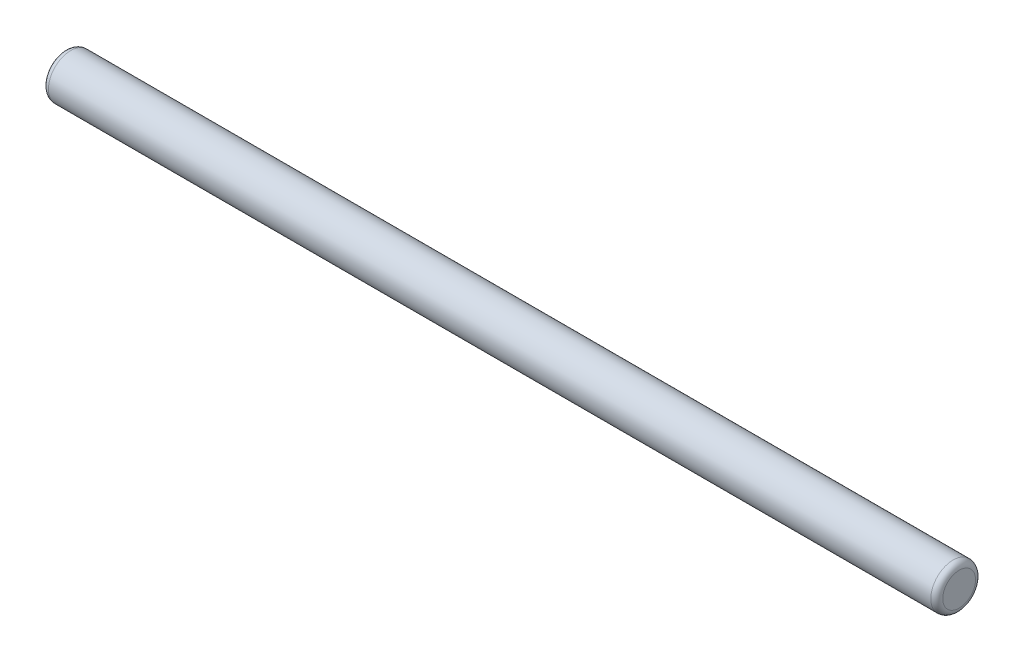
from build123d import *

# Parameters (mm, degrees)
SKETCH1_R           = 0.075
BOSS_EXTRUDE1_DEPTH = 3
FILLET1_R           = 0.02


with BuildPart() as part:
    # Sketch1 → Boss-Extrude1 (new body)
    with BuildSketch(Plane(origin=(0, 0, 0), x_dir=(0, 0, -1), z_dir=(1, 0, 0))):
        Circle(SKETCH1_R)
    extrude(amount=BOSS_EXTRUDE1_DEPTH)

    # Fillet1
    fillet1_edges = [part.edges().sort_by_distance(p)[0] for p in [
        (0, 0, 0.075),
        (3, 0, 0.075),
    ]]
    fillet(fillet1_edges, radius=FILLET1_R)


solid = part.part
